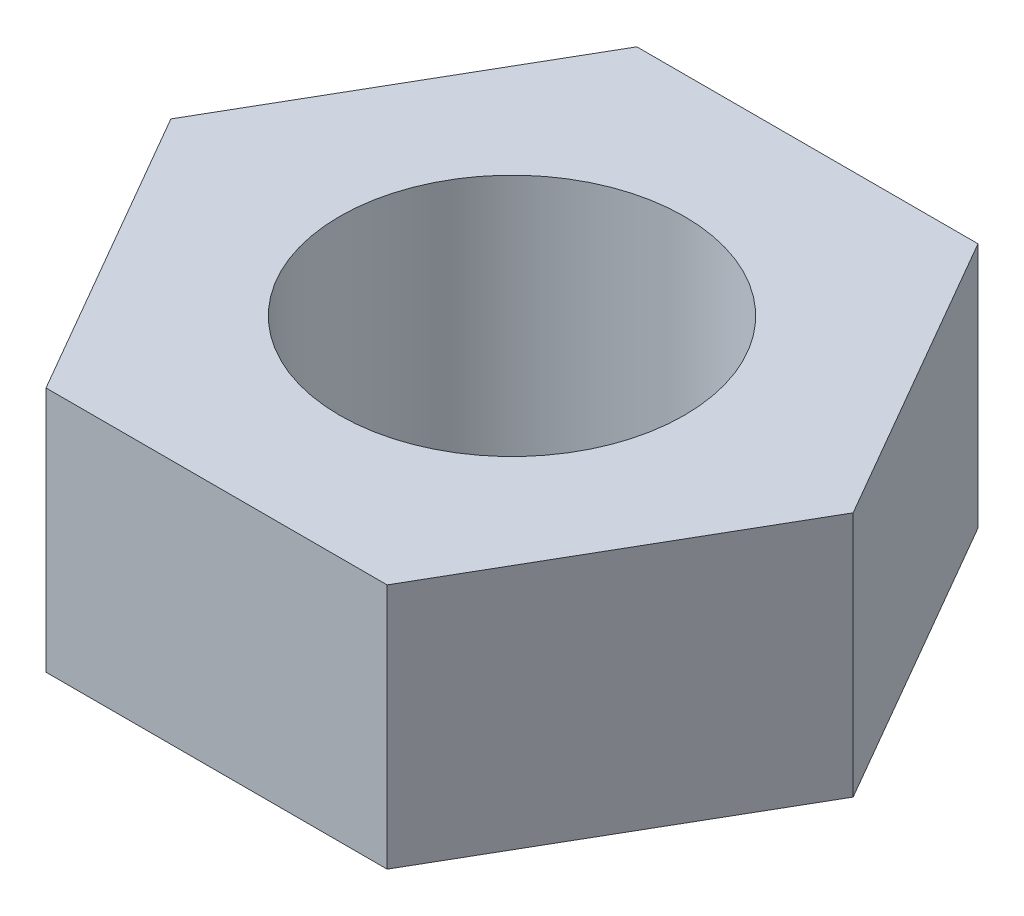
from build123d import *

# Parameters (mm, degrees)
SKETCH2_R           = 7
BOSS_EXTRUDE1_DEPTH = 10


with BuildPart() as part:
    # Sketch2 → Boss-Extrude1 (new body)
    with BuildSketch(Plane(origin=(0, 0, 0), x_dir=(1, 0, 0), z_dir=(0, 1, 0))):
        Polygon((6.92820323, 12), (-6.92820323, 12), (-13.856406461, 0), (-6.92820323, -12), (6.92820323, -12), (13.856406461, 0), align=None)
        with Locations(Location((0, 0, 0), (0, 0, 270))):
            Circle(SKETCH2_R, mode=Mode.SUBTRACT)
    extrude(amount=-BOSS_EXTRUDE1_DEPTH)


solid = part.part
